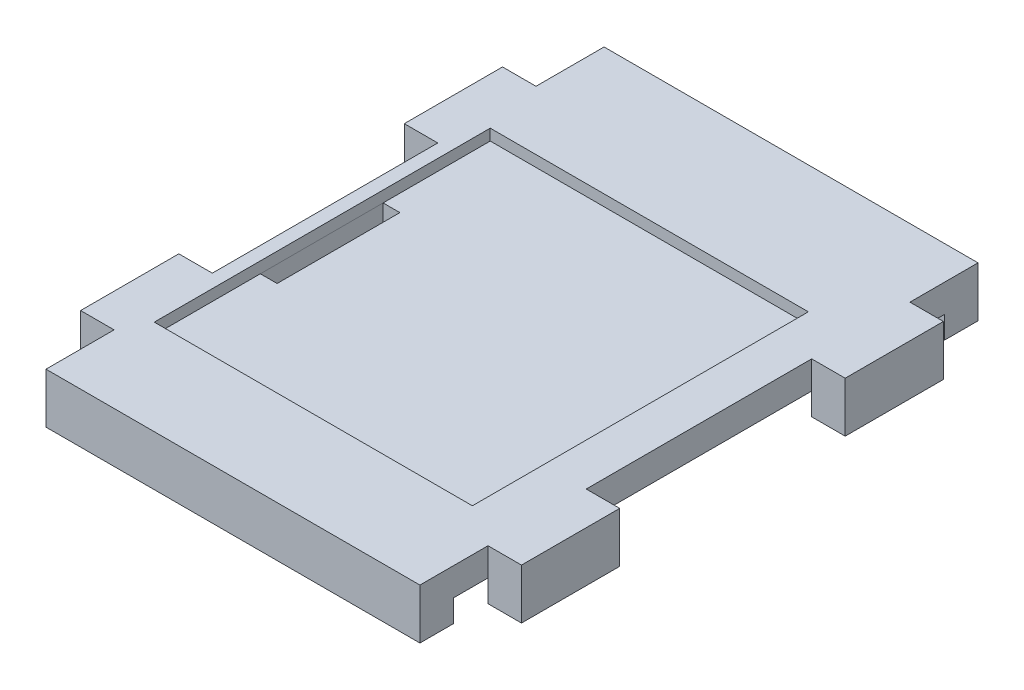
from build123d import *

# Parameters (mm, degrees)
SKETCH3_W           = 39.5
SKETCH3_H           = 50
SKETCH3_W_2         = 33.5
SKETCH3_H_2         = 44
BOSS_EXTRUDE1_DEPTH = 2
SKETCH4_W           = 39.5
SKETCH4_H           = 50
BOSS_EXTRUDE2_DEPTH = 1.5
SKETCH5_W           = 1.5
SKETCH5_H           = 11
CUT_EXTRUDE1_DEPTH  = 3
SKETCH7_W           = 39.5
SKETCH7_H           = 50
SKETCH7_W_2         = 28.5
SKETCH7_H_2         = 30.1
BOSS_EXTRUDE3_DEPTH = 1
SKETCH8_W           = 3
SKETCH8_H           = 6.1
SKETCH8_H_2         = 20.2
CUT_EXTRUDE2_DEPTH  = 4.5


with BuildPart() as part:
    # Sketch3 → Boss-Extrude1 (new body)
    with BuildSketch(Plane(origin=(0, 0, 0), x_dir=(1, 0, 0), z_dir=(0, 1, 0))):
        with Locations((19.75, 25)):
            Rectangle(SKETCH3_W, SKETCH3_H)
        with Locations((19.75, 25)):
            Rectangle(SKETCH3_W_2, SKETCH3_H_2, mode=Mode.SUBTRACT)
    extrude(amount=BOSS_EXTRUDE1_DEPTH)

    # Sketch4 → Boss-Extrude2 (add)
    with BuildSketch(Plane(origin=(0, 2, 0), x_dir=(1, 0, 0), z_dir=(0, 1, 0))):
        with Locations((19.75, 25)):
            Rectangle(SKETCH4_W, SKETCH4_H)
    extrude(amount=BOSS_EXTRUDE2_DEPTH)

    # Sketch5 → Cut-Extrude1 (cut)
    with BuildSketch(Plane(origin=(0, 3.5, 0), x_dir=(1, 0, 0), z_dir=(0, 1, 0))):
        with Locations((4.956023136, 23.5)):
            Rectangle(SKETCH5_W, SKETCH5_H)
    extrude(amount=-CUT_EXTRUDE1_DEPTH, mode=Mode.SUBTRACT)

    # Sketch7 → Boss-Extrude3 (add)
    with BuildSketch(Plane(origin=(0, 3.5, 0), x_dir=(1, 0, 0), z_dir=(0, 1, 0))):
        with Locations((19.75, 25)):
            Rectangle(SKETCH7_W, SKETCH7_H)
        with Locations((18.45, 23.55)):
            Rectangle(SKETCH7_W_2, SKETCH7_H_2, mode=Mode.SUBTRACT)
    extrude(amount=BOSS_EXTRUDE3_DEPTH)

    # Sketch8 → Cut-Extrude2 (cut)
    with BuildSketch(Plane.XZ):
        with Locations((1.5, -3.05)):
            Rectangle(SKETCH8_W, SKETCH8_H)
        with Locations((1.5, -25)):
            Rectangle(SKETCH8_W, SKETCH8_H_2)
        with Locations((1.5, -46.95)):
            Rectangle(SKETCH8_W, SKETCH8_H)
        with Locations((38, -3.05)):
            Rectangle(SKETCH8_W, SKETCH8_H)
        with Locations((38, -25)):
            Rectangle(SKETCH8_W, SKETCH8_H_2)
        with Locations((38, -46.95)):
            Rectangle(SKETCH8_W, SKETCH8_H)
    extrude(amount=-CUT_EXTRUDE2_DEPTH, mode=Mode.SUBTRACT)


solid = part.part
